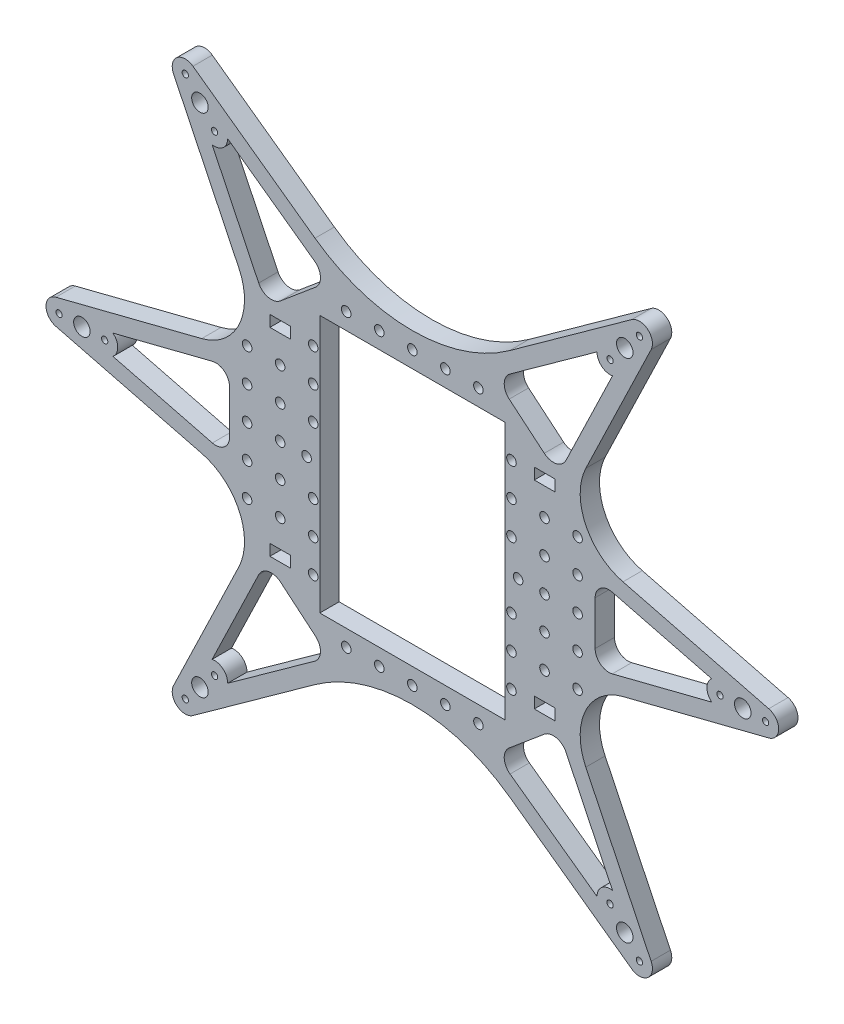
from build123d import *

# Parameters (mm, degrees)
SKETCH1_R           = 0.95
SKETCH1_R_2         = 2.5
SKETCH1_R_3         = 1.449999999
SKETCH1_R_4         = 1.45
SKETCH1_W           = 6.2
SKETCH1_H           = 3.4
SKETCH1_W_2         = 56
SKETCH1_H_2         = 78
BOSS_EXTRUDE1_DEPTH = 5.85


with BuildPart() as part:
    # Sketch1 → Boss-Extrude1 (new body)
    with BuildSketch(Plane.XY):
        with BuildLine():
            Line((576.535234906, 435.509706558), (532.426650002, 446.716128422))
            ThreePointArc((532.426650002, 446.716128422), (529.426650002, 450.550186325), (532.426650002, 454.384244227))
            Line((532.426650002, 454.384244227), (576.535234906, 465.590666092))
            ThreePointArc((576.535234906, 465.590666092), (587.878503901, 474.983843125), (587.782782207, 489.711109118))
            Line((587.782782207, 489.711109118), (568.014947547, 530.703594601))
            ThreePointArc((568.014947547, 530.703594601), (569.023643468, 535.466212845), (573.889065048, 535.63256443))
            Line((573.889065048, 535.63256443), (610.826134102, 509.046777194))
            ThreePointArc((610.826134102, 509.046777194), (640.276650002, 499.550186325), (669.727165903, 509.046777194))
            Line((669.727165903, 509.046777194), (706.664234956, 535.63256443))
            ThreePointArc((706.664234956, 535.63256443), (711.529656536, 535.466212845), (712.538352458, 530.703594601))
            Line((712.538352458, 530.703594601), (692.770517798, 489.711109118))
            ThreePointArc((692.770517798, 489.711109118), (692.674796103, 474.983843125), (704.018065099, 465.590666092))
            Line((704.018065099, 465.590666092), (748.126650002, 454.384244227))
            ThreePointArc((748.126650002, 454.384244227), (751.126650002, 450.550186325), (748.126650002, 446.716128422))
            Line((748.126650002, 446.716128422), (704.018065099, 435.509706558))
            ThreePointArc((704.018065099, 435.509706558), (692.674796103, 426.116529525), (692.770517798, 411.389263532))
            Line((692.770517798, 411.389263532), (712.538352458, 370.396778049))
            ThreePointArc((712.538352458, 370.396778049), (711.529656536, 365.634159805), (706.664234956, 365.46780822))
            Line((706.664234956, 365.46780822), (669.727165903, 392.053595455))
            ThreePointArc((669.727165903, 392.053595455), (640.276650002, 401.550186325), (610.826134101, 392.053595455))
            Line((610.826134101, 392.053595455), (573.889065048, 365.46780822))
            ThreePointArc((573.889065048, 365.46780822), (569.023643468, 365.634159805), (568.014947547, 370.396778049))
            Line((568.014947547, 370.396778049), (587.782782207, 411.389263532))
            ThreePointArc((587.782782207, 411.389263532), (587.878503901, 426.116529525), (576.535234906, 435.509706558))
        make_face()
        with Locations((533.376650002, 450.550186325)):
            Circle(SKETCH1_R, mode=Mode.SUBTRACT)
        with Locations((575.997889034, 527.154630637)):
            Circle(SKETCH1_R_2, mode=Mode.SUBTRACT)
        with Locations((547.176650002, 450.550186325)):
            Circle(SKETCH1_R, mode=Mode.SUBTRACT)
        with Locations((540.276650002, 450.550186325)):
            Circle(SKETCH1_R_2, mode=Mode.SUBTRACT)
        with Locations((590.276650002, 460.550186325)):
            Circle(SKETCH1_R_3, mode=Mode.SUBTRACT)
        with Locations((571.562654527, 532.440337294)):
            Circle(SKETCH1_R, mode=Mode.SUBTRACT)
        with Locations((580.43312354, 521.868923979)):
            Circle(SKETCH1_R, mode=Mode.SUBTRACT)
        with Locations((680.276650002, 470.550186325)):
            Circle(SKETCH1_R_4, mode=Mode.SUBTRACT)
        with Locations((610.276650002, 480.550186325)):
            Circle(SKETCH1_R_4, mode=Mode.SUBTRACT)
        with Locations((610.276650002, 470.550186325)):
            Circle(SKETCH1_R_4, mode=Mode.SUBTRACT)
        with Locations((610.276650002, 460.550186325)):
            Circle(SKETCH1_R_4, mode=Mode.SUBTRACT)
        with Locations((608.276650002, 450.550186325)):
            Circle(SKETCH1_R_4, mode=Mode.SUBTRACT)
        with Locations((630.276650002, 494.550186325)):
            Circle(SKETCH1_R_4, mode=Mode.SUBTRACT)
        with Locations((620.276650002, 494.550186325)):
            Circle(SKETCH1_R_4, mode=Mode.SUBTRACT)
        with Locations((640.276650002, 406.550186325)):
            Circle(SKETCH1_R_4, mode=Mode.SUBTRACT)
        with Locations((630.276650002, 406.550186325)):
            Circle(SKETCH1_R_4, mode=Mode.SUBTRACT)
        with Locations((620.276650002, 406.550186325)):
            Circle(SKETCH1_R_4, mode=Mode.SUBTRACT)
        with Locations((670.276650002, 420.550186325)):
            Circle(SKETCH1_R_4, mode=Mode.SUBTRACT)
        with Locations((580.43312354, 379.231448671)):
            Circle(SKETCH1_R, mode=Mode.SUBTRACT)
        with Locations((575.997889034, 373.945742013)):
            Circle(SKETCH1_R_2, mode=Mode.SUBTRACT)
        with Locations((571.562654527, 368.660035356)):
            Circle(SKETCH1_R, mode=Mode.SUBTRACT)
        with Locations((590.276650002, 430.550186325)):
            Circle(SKETCH1_R_3, mode=Mode.SUBTRACT)
        with Locations((670.276650002, 430.550186325)):
            Circle(SKETCH1_R_4, mode=Mode.SUBTRACT)
        with Locations((590.276650002, 440.550186325)):
            Circle(SKETCH1_R_3, mode=Mode.SUBTRACT)
        with Locations((670.276650002, 440.550186325)):
            Circle(SKETCH1_R_4, mode=Mode.SUBTRACT)
        with Locations((610.276650002, 440.550186325)):
            Circle(SKETCH1_R_4, mode=Mode.SUBTRACT)
        with Locations((590.276650002, 470.550186325)):
            Circle(SKETCH1_R_3, mode=Mode.SUBTRACT)
        with Locations((680.276650002, 430.550186325)):
            Circle(SKETCH1_R_4, mode=Mode.SUBTRACT)
        with Locations((708.990645478, 368.660035356)):
            Circle(SKETCH1_R, mode=Mode.SUBTRACT)
        with Locations((704.555410971, 373.945742013)):
            Circle(SKETCH1_R_2, mode=Mode.SUBTRACT)
        with Locations((700.120176464, 379.231448671)):
            Circle(SKETCH1_R, mode=Mode.SUBTRACT)
        with Locations((660.276650002, 406.550186325)):
            Circle(SKETCH1_R_4, mode=Mode.SUBTRACT)
        with Locations((650.276650002, 406.550186325)):
            Circle(SKETCH1_R_4, mode=Mode.SUBTRACT)
        with Locations((660.276650002, 494.550186325)):
            Circle(SKETCH1_R_4, mode=Mode.SUBTRACT)
        with Locations((650.276650002, 494.550186325)):
            Circle(SKETCH1_R_4, mode=Mode.SUBTRACT)
        with Locations((672.276650002, 450.550186325)):
            Circle(SKETCH1_R_4, mode=Mode.SUBTRACT)
        with Locations((670.276650002, 460.550186325)):
            Circle(SKETCH1_R_4, mode=Mode.SUBTRACT)
        with Locations((670.276650002, 470.550186325)):
            Circle(SKETCH1_R_4, mode=Mode.SUBTRACT)
        with Locations((700.120176464, 521.868923979)):
            Circle(SKETCH1_R, mode=Mode.SUBTRACT)
        with Locations((708.990645478, 532.440337294)):
            Circle(SKETCH1_R, mode=Mode.SUBTRACT)
        with Locations((690.276650002, 450.550186325)):
            Circle(SKETCH1_R_3, mode=Mode.SUBTRACT)
        with Locations((740.276650002, 450.550186325)):
            Circle(SKETCH1_R_2, mode=Mode.SUBTRACT)
        with Locations((610.276650002, 430.550186325)):
            Circle(SKETCH1_R_4, mode=Mode.SUBTRACT)
        with Locations((733.376650002, 450.550186325)):
            Circle(SKETCH1_R, mode=Mode.SUBTRACT)
        with Locations((704.555410971, 527.154630637)):
            Circle(SKETCH1_R_2, mode=Mode.SUBTRACT)
        with Locations((747.176650002, 450.550186325)):
            Circle(SKETCH1_R, mode=Mode.SUBTRACT)
        with Locations((610.276650002, 420.550186325)):
            Circle(SKETCH1_R_4, mode=Mode.SUBTRACT)
        with Locations((670.276650002, 480.550186325)):
            Circle(SKETCH1_R_4, mode=Mode.SUBTRACT)
        with Locations((690.276650002, 470.550186325)):
            Circle(SKETCH1_R_3, mode=Mode.SUBTRACT)
        with Locations((640.276650002, 494.550186325)):
            Circle(SKETCH1_R_4, mode=Mode.SUBTRACT)
        with Locations((690.276650002, 440.550186325)):
            Circle(SKETCH1_R_3, mode=Mode.SUBTRACT)
        with Locations((690.276650002, 430.550186325)):
            Circle(SKETCH1_R_3, mode=Mode.SUBTRACT)
        with Locations((690.276650002, 460.550186325)):
            Circle(SKETCH1_R_3, mode=Mode.SUBTRACT)
        with Locations((600.276650002, 460.550186325)):
            Circle(SKETCH1_R_4, mode=Mode.SUBTRACT)
        with Locations((590.276650002, 450.550186325)):
            Circle(SKETCH1_R_3, mode=Mode.SUBTRACT)
        with Locations((600.276650002, 450.550186325)):
            Circle(SKETCH1_R_4, mode=Mode.SUBTRACT)
        with Locations((600.276650002, 440.550186325)):
            Circle(SKETCH1_R_4, mode=Mode.SUBTRACT)
        with Locations((600.276650002, 430.550186325)):
            Circle(SKETCH1_R_4, mode=Mode.SUBTRACT)
        with Locations((680.276650002, 440.550186325)):
            Circle(SKETCH1_R_4, mode=Mode.SUBTRACT)
        with Locations((680.276650002, 450.550186325)):
            Circle(SKETCH1_R_4, mode=Mode.SUBTRACT)
        with Locations((680.276650002, 460.550186325)):
            Circle(SKETCH1_R_4, mode=Mode.SUBTRACT)
        with Locations((600.276650002, 470.550186325)):
            Circle(SKETCH1_R_4, mode=Mode.SUBTRACT)
        with BuildLine():
            Line((549.676990781, 453.60809345), (579.759065287, 461.250878142))
            ThreePointArc((579.759065287, 461.250878142), (583.347665629, 460.500618715), (584.958485434, 457.207261586))
            Line((584.958485434, 457.207261586), (584.958485434, 443.893111064))
            ThreePointArc((584.958485434, 443.893111064), (583.347665629, 440.599753935), (579.759065287, 439.849494508))
            Line((579.759065287, 439.849494508), (549.676990781, 447.492279199))
            ThreePointArc((549.676990781, 447.492279199), (551.126650002, 450.550186325), (549.676990781, 453.60809345))
        make_face(mode=Mode.SUBTRACT)
        with Locations((600.276650002, 420.550186325)):
            Rectangle(SKETCH1_W, SKETCH1_H, mode=Mode.SUBTRACT)
        with Locations((640.276650002, 450.550186325)):
            Rectangle(SKETCH1_W_2, SKETCH1_H_2, mode=Mode.SUBTRACT)
        with BuildLine():
            Line((600.348338396, 413.736986518), (610.956203967, 404.83593043))
            ThreePointArc((610.956203967, 404.83593043), (612.471993126, 401.421183728), (610.707011042, 398.128320223))
            Line((610.707011042, 398.128320223), (584.382804374, 379.181236018))
            ThreePointArc((584.382804374, 379.181236018), (582.972134599, 382.257324221), (579.697818852, 383.112405642))
            Line((579.697818852, 383.112405642), (593.785903757, 412.326815104))
            ThreePointArc((593.785903757, 412.326815104), (596.722255344, 414.636782892), (600.348338396, 413.736986518))
        make_face(mode=Mode.SUBTRACT)
        with BuildLine():
            Line((579.697818852, 517.987967008), (593.785903757, 488.773557545))
            ThreePointArc((593.785903757, 488.773557545), (596.722255344, 486.463589758), (600.348338397, 487.363386132))
            Line((600.348338397, 487.363386132), (610.956203967, 496.264442219))
            ThreePointArc((610.956203967, 496.264442219), (612.471993126, 499.679188922), (610.707011042, 502.972052427))
            Line((610.707011042, 502.972052427), (584.382804374, 521.919136631))
            ThreePointArc((584.382804374, 521.919136631), (582.972134599, 518.843048429), (579.697818852, 517.987967008))
        make_face(mode=Mode.SUBTRACT)
        with Locations((680.276650002, 480.550186325)):
            Rectangle(SKETCH1_W, SKETCH1_H, mode=Mode.SUBTRACT)
        with BuildLine():
            Line((669.597096038, 496.264442219), (680.204961608, 487.363386132))
            ThreePointArc((680.204961608, 487.363386132), (683.831044661, 486.463589758), (686.767396247, 488.773557545))
            Line((686.767396247, 488.773557545), (700.855481152, 517.987967008))
            ThreePointArc((700.855481152, 517.987967008), (697.581165406, 518.843048429), (696.17049563, 521.919136631))
            Line((696.17049563, 521.919136631), (669.846288962, 502.972052427))
            ThreePointArc((669.846288962, 502.972052427), (668.081306878, 499.679188922), (669.597096038, 496.264442219))
        make_face(mode=Mode.SUBTRACT)
        with BuildLine():
            Line((696.17049563, 379.181236018), (669.846288963, 398.128320223))
            ThreePointArc((669.846288963, 398.128320223), (668.081306878, 401.421183728), (669.597096038, 404.83593043))
            Line((669.597096038, 404.83593043), (680.204961608, 413.736986518))
            ThreePointArc((680.204961608, 413.736986518), (683.831044661, 414.636782892), (686.767396247, 412.326815104))
            Line((686.767396247, 412.326815104), (700.855481152, 383.112405642))
            ThreePointArc((700.855481152, 383.112405642), (697.581165406, 382.257324221), (696.17049563, 379.181236018))
        make_face(mode=Mode.SUBTRACT)
        with BuildLine():
            Line((695.594814571, 457.207261586), (695.594814571, 443.893111064))
            ThreePointArc((695.594814571, 443.893111064), (697.205634375, 440.599753935), (700.794234717, 439.849494508))
            Line((700.794234717, 439.849494508), (730.876309223, 447.492279199))
            ThreePointArc((730.876309223, 447.492279199), (729.426650002, 450.550186325), (730.876309223, 453.60809345))
            Line((730.876309223, 453.60809345), (700.794234717, 461.250878142))
            ThreePointArc((700.794234717, 461.250878142), (697.205634375, 460.500618715), (695.594814571, 457.207261586))
        make_face(mode=Mode.SUBTRACT)
        with Locations((680.276650002, 420.550186325)):
            Rectangle(SKETCH1_W, SKETCH1_H, mode=Mode.SUBTRACT)
        with Locations((600.276650002, 480.550186325)):
            Rectangle(SKETCH1_W, SKETCH1_H, mode=Mode.SUBTRACT)
    extrude(amount=BOSS_EXTRUDE1_DEPTH)


solid = part.part
